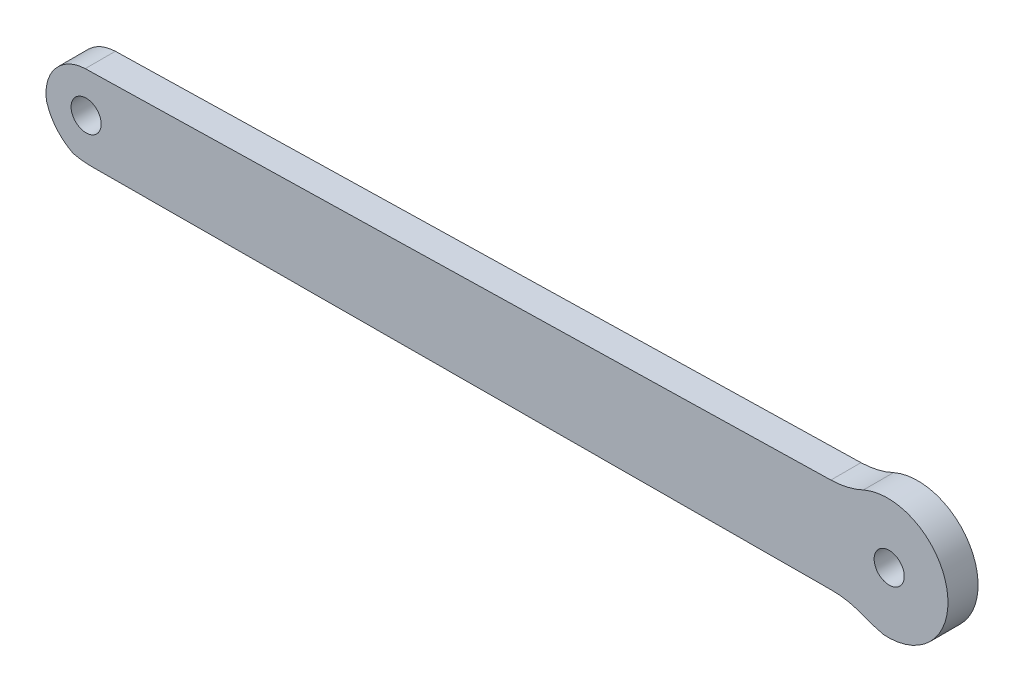
from build123d import *

# Parameters (mm, degrees)
SKETCH_1_R      = 1.5
EXTRUDE_1_DEPTH = 3


with BuildPart() as part:
    # 草圖1 → 填料-伸長1 (new body)
    with BuildSketch(Plane.XY):
        with BuildLine():
            Line((28.43076164, 146.77282614), (84.081040564, 147.012256058))
            ThreePointArc((84.081040564, 147.012256058), (85.747384171, 146.841113393), (87.341537057, 146.326655031))
            ThreePointArc((87.341537057, 146.326655031), (88.27023729, 146.018781), (89.213720756, 145.759726003))
            ThreePointArc((89.213720756, 145.759726003), (95.537127916, 152.779296104), (87.206898507, 157.236550922))
            ThreePointArc((87.206898507, 157.236550922), (85.625904315, 156.682898569), (83.964278534, 156.470593769))
            Line((83.964278534, 156.470593769), (9.689328559, 154.823969204))
            ThreePointArc((9.689328559, 154.823969204), (6.708309072, 153.340450311), (5.825145652, 150.129947568))
            ThreePointArc((5.825145652, 150.129947568), (6.818352081, 148.234093963), (8.49347494, 146.901921561))
            ThreePointArc((8.49347494, 146.901921561), (9.408892458, 146.744827981), (10.336347773, 146.694885369))
            Line((10.336347773, 146.694885369), (28.43076164, 146.77282614))
        make_face()
        with Locations((89.77184724, 151.812467685)):
            Circle(SKETCH_1_R, mode=Mode.SUBTRACT)
        with Locations((9.777984027, 150.8249518)):
            Circle(SKETCH_1_R, mode=Mode.SUBTRACT)
    extrude(amount=EXTRUDE_1_DEPTH)


solid = part.part
